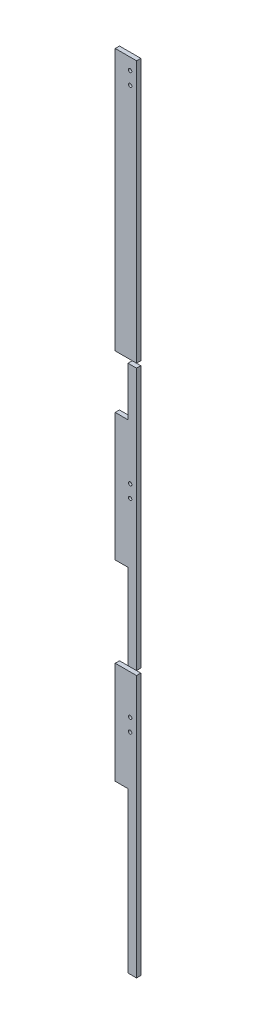
from build123d import *

# Parameters (mm, degrees)
SKETCH_1_W        = 10
SKETCH_1_H        = 123
SKETCH_1_R        = 0.8
EXTRUDE_1_DEPTH   = 2
EXTRUDE_1_2_DEPTH = 2
EXTRUDE_1_3_DEPTH = 2


with BuildPart() as part:
    # 草图1 → 凸台-拉伸1 (new body)
    with BuildSketch(Plane.XY):
        with Locations((125.787596038, -828.51)):
            Rectangle(SKETCH_1_W, SKETCH_1_H)
        with Locations((127.787596038, -772.51)):
            Circle(SKETCH_1_R, mode=Mode.SUBTRACT)
        with Locations((127.787596038, -778.51)):
            Circle(SKETCH_1_R, mode=Mode.SUBTRACT)
    extrude(amount=EXTRUDE_1_DEPTH)


with BuildPart() as body_2:
    # 草图1 → Extrude 1 2 (new body)
    with BuildSketch(Plane.XY):
        Polygon((120.787596038, -975.01), (126.787596038, -975.01), (126.787596038, -1015.01), (130.787596038, -1015.01), (130.787596038, -985.01), (130.787596038, -925.01), (130.787596038, -892.01), (126.787596038, -892.01), (126.787596038, -915.01), (120.787596038, -915.01), align=None)
        with Locations((127.787596038, -940.51)):
            Circle(SKETCH_1_R, mode=Mode.SUBTRACT)
        with Locations((127.787596038, -946.51)):
            Circle(SKETCH_1_R, mode=Mode.SUBTRACT)
    extrude(amount=EXTRUDE_1_2_DEPTH)


with BuildPart() as body_3:
    # 草图1 → Extrude 1 3 (new body)
    with BuildSketch(Plane.XY):
        Polygon((120.787596038, -1017.01), (130.787596038, -1017.01), (130.787596038, -1076.01), (130.787596038, -1140.01), (126.787596038, -1140.01), (126.787596038, -1065.01), (120.787596038, -1065.01), align=None)
        with Locations((127.787596038, -1035.51)):
            Circle(SKETCH_1_R, mode=Mode.SUBTRACT)
        with Locations((127.787596038, -1041.51)):
            Circle(SKETCH_1_R, mode=Mode.SUBTRACT)
    extrude(amount=EXTRUDE_1_3_DEPTH)


solid = Compound([part.part, body_2.part, body_3.part])
